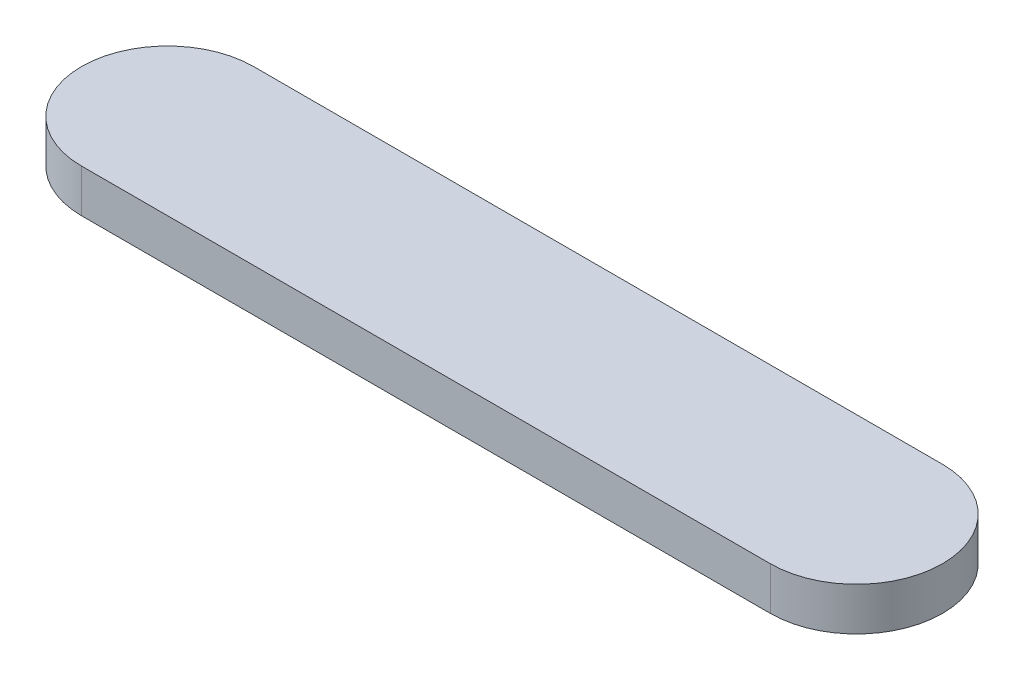
from build123d import *

# Parameters (mm, degrees)
EXTRUDE_1_DEPTH = 25


with BuildPart() as part:
    # 草图1 → 凸台-拉伸1 (new body)
    with BuildSketch(Plane(origin=(0, 0, 0), x_dir=(1, 0, 0), z_dir=(0, 1, 0))):
        with BuildLine():
            Line((0, 50), (400, 50))
            ThreePointArc((400, 50), (450, 0), (400, -50))
            Line((400, -50), (0, -50))
            ThreePointArc((0, -50), (-50, 0), (0, 50))
        make_face()
    extrude(amount=EXTRUDE_1_DEPTH)


solid = part.part
